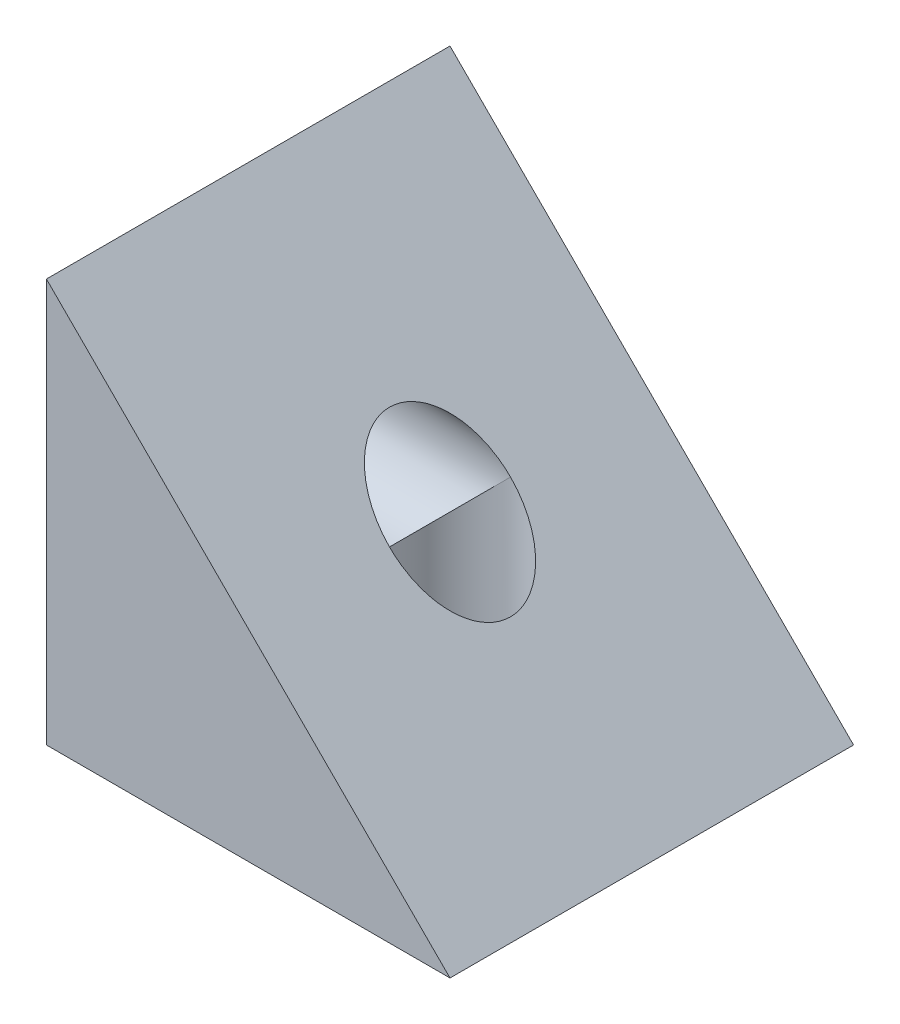
from build123d import *

# Parameters (mm, degrees)
EXTRUDE_1_DEPTH          = 5
CUT_EXTRUDE_1_DEPTH      = 13.247448714
CUT_EXTRUDE_1_DEPTH_BACK = 13.247448714
SKETCH_2_R               = 1.5
CUT_EXTRUDE_2_DEPTH      = 13.247448714
CUT_EXTRUDE_2_DEPTH_BACK = 13.247448714
SKETCH_3_R               = 1.5


with BuildPart() as part:
    # 草图1 → 凸台-拉伸1 (new, symmetric)
    with BuildSketch(Plane.XY):
        Polygon((-5, 5), (-5, -5), (5, -5), align=None)
    extrude(amount=EXTRUDE_1_DEPTH, both=True)

    # 草图2 → 切除-拉伸1 (cut, two sides: drawn at the far end of the back side and taken through both)
    with BuildSketch(Plane.ZY.offset(5).offset(-CUT_EXTRUDE_1_DEPTH_BACK)):
        with Locations(Location((0, 0, 0), (0, 0, 90))):
            Circle(SKETCH_2_R)
    extrude(amount=CUT_EXTRUDE_1_DEPTH + CUT_EXTRUDE_1_DEPTH_BACK, mode=Mode.SUBTRACT)

    # 草图3 → 切除-拉伸2 (cut, two sides: drawn at the far end of the back side and taken through both)
    with BuildSketch(Plane.XZ.offset(5).offset(-CUT_EXTRUDE_2_DEPTH_BACK)):
        with Locations(Location((0, 0, 0), (0, 0, 90))):
            Circle(SKETCH_3_R)
    extrude(amount=CUT_EXTRUDE_2_DEPTH + CUT_EXTRUDE_2_DEPTH_BACK, mode=Mode.SUBTRACT)


solid = part.part
